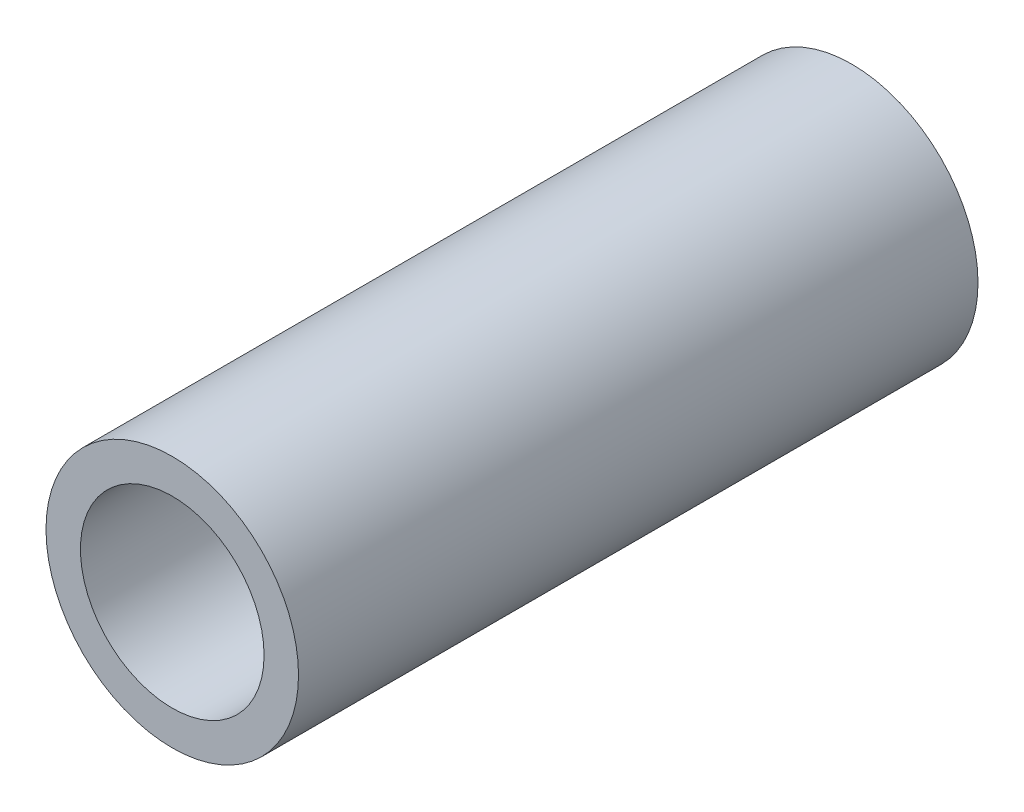
from build123d import *

# Parameters (mm, degrees)
SKETCH_1_R      = 2.75
SKETCH_1_R_2    = 2
EXTRUDE_1_DEPTH = 14.8


with BuildPart() as part:
    # 草图1 → 凸台-拉伸1 (new body)
    with BuildSketch(Plane.XY):
        Circle(SKETCH_1_R)
        Circle(SKETCH_1_R_2, mode=Mode.SUBTRACT)
    extrude(amount=-EXTRUDE_1_DEPTH)


solid = part.part
